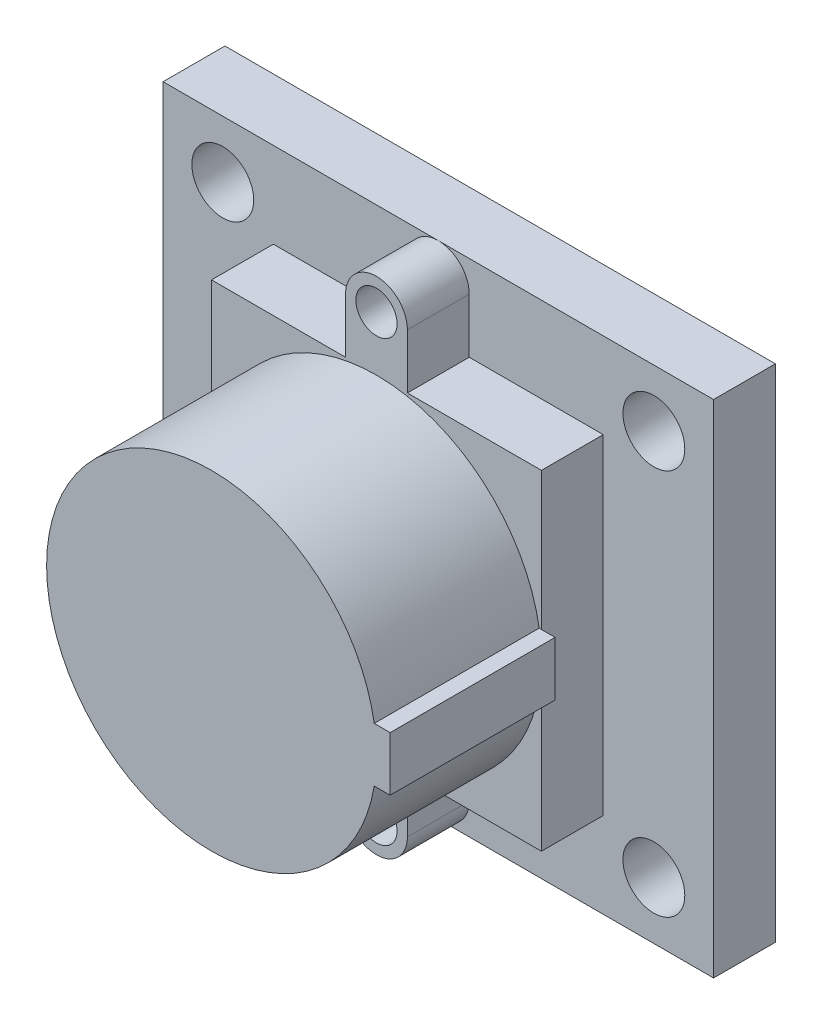
from build123d import *

# Parameters (mm, degrees)
SKETCH_1_W      = 26.7
SKETCH_1_H      = 24.3
SKETCH_1_R      = 1.5
EXTRUDE_1_DEPTH = 3
SKETCH_2_R      = 1
EXTRUDE_2_DEPTH = 3
EXTRUDE_3_DEPTH = 8


with BuildPart() as part:
    # 草图1 → 凸台-拉伸1 (new body)
    with BuildSketch(Plane.XY):
        with Locations((20.044402297, 0)):
            Rectangle(SKETCH_1_W, SKETCH_1_H)
        with Locations((30.499402297, 9.375)):
            Circle(SKETCH_1_R, mode=Mode.SUBTRACT)
        with Locations((9.589402297, 9.375)):
            Circle(SKETCH_1_R, mode=Mode.SUBTRACT)
        with Locations((30.499402297, -9.375)):
            Circle(SKETCH_1_R, mode=Mode.SUBTRACT)
        with Locations((9.589402297, -9.375)):
            Circle(SKETCH_1_R, mode=Mode.SUBTRACT)
    extrude(amount=EXTRUDE_1_DEPTH)

    # 草图2 → 凸台-拉伸2 (add)
    with BuildSketch(Plane.XY.offset(3)):
        with BuildLine():
            Line((12.044402297, 8), (18.544402297, 8))
            Line((18.544402297, 8), (18.544402297, 10.65))
            ThreePointArc((18.544402297, 10.65), (20.044402297, 12.15), (21.544402297, 10.65))
            Line((21.544402297, 10.65), (21.544402297, 8))
            Line((21.544402297, 8), (28.044402297, 8))
            Line((28.044402297, 8), (28.044402297, 1.75))
            Line((28.044402297, 1.75), (28.044402297, -1.75))
            Line((28.044402297, -1.75), (28.044402297, -8))
            Line((28.044402297, -8), (21.544402297, -8))
            Line((21.544402297, -8), (21.544402297, -10.65))
            ThreePointArc((21.544402297, -10.65), (20.044402297, -12.15), (18.544402297, -10.65))
            Line((18.544402297, -10.65), (18.544402297, -8))
            Line((18.544402297, -8), (12.044402297, -8))
            Line((12.044402297, -8), (12.044402297, -1.75))
            Line((12.044402297, -1.75), (12.044402297, 1.75))
            Line((12.044402297, 1.75), (12.044402297, 8))
        make_face()
        with Locations((20.044402297, 10.65)):
            Circle(SKETCH_2_R, mode=Mode.SUBTRACT)
        with Locations((20.044402297, -10.65)):
            Circle(SKETCH_2_R, mode=Mode.SUBTRACT)
    extrude(amount=EXTRUDE_2_DEPTH)

    # 草图3 → 凸台-拉伸3 (add)
    with BuildSketch(Plane.XY.offset(6)):
        with BuildLine():
            Line((27.935532249, 1.315320523), (28.709062769, 1.315320523))
            Line((28.709062769, 1.315320523), (28.709062769, -1.315320523))
            Line((28.709062769, -1.315320523), (27.935532249, -1.315320523))
            ThreePointArc((27.935532249, -1.315320523), (12.044402297, 0), (27.935532249, 1.315320523))
        make_face()
    extrude(amount=EXTRUDE_3_DEPTH)


solid = part.part
